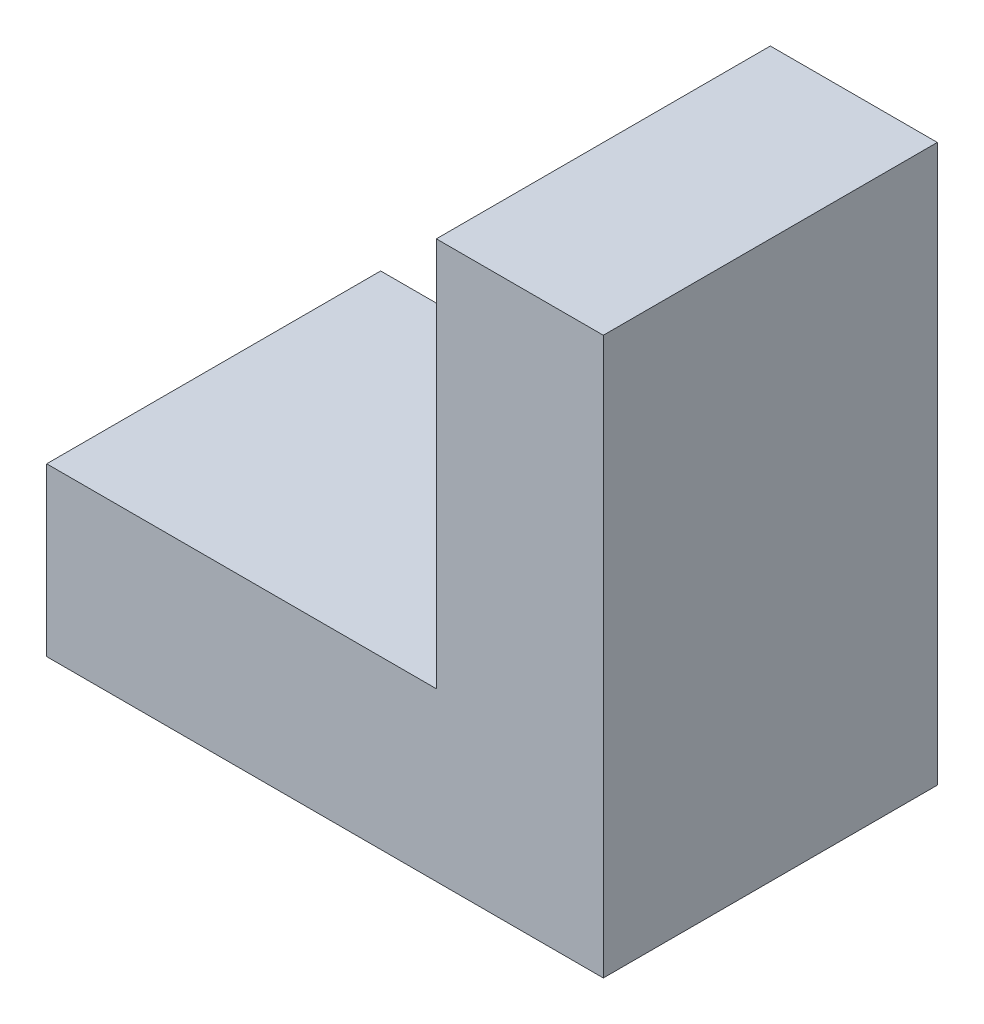
from build123d import *

# Parameters (mm, degrees)
F_12_CORNER_CLEAT_DEPTH = 12


with BuildPart() as part:
    # Эскиз1 → 12_Corner_cleat (new body)
    with BuildSketch(Plane.XY):
        Polygon((-10, 0), (10, 0), (10, 20), (4, 20), (4, 6), (-10, 6), align=None)
    extrude(amount=F_12_CORNER_CLEAT_DEPTH)


solid = part.part
